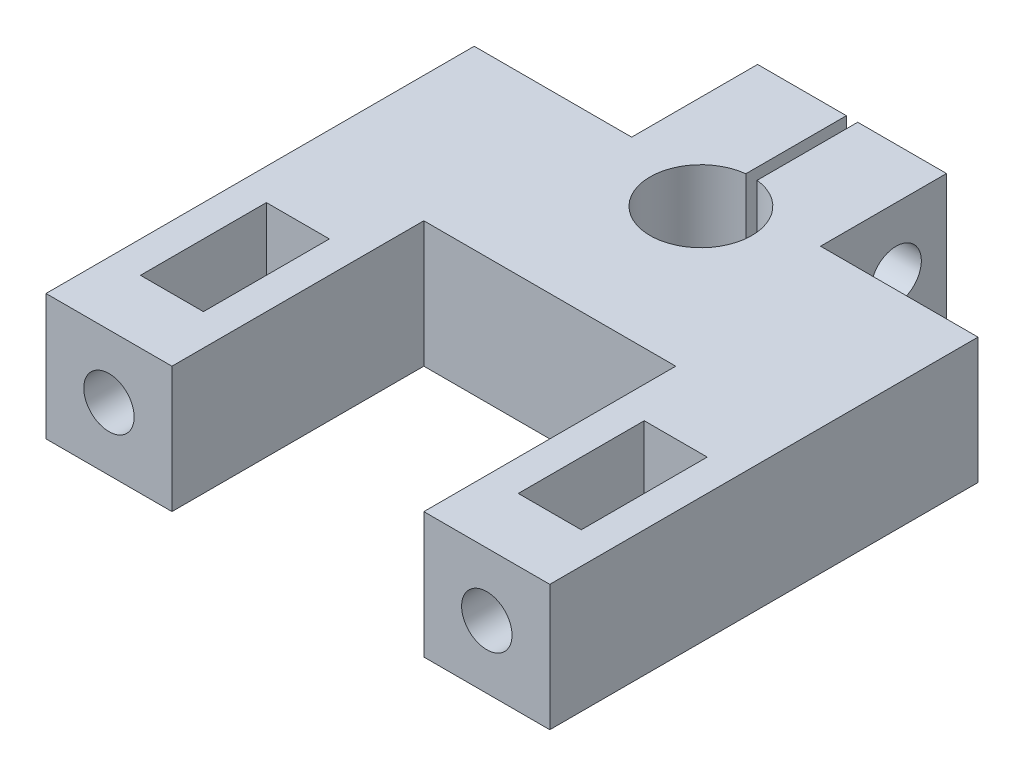
from build123d import *

# Parameters (mm, degrees)
BOSS_EXTRUDE1_DEPTH = 10
SKETCH2_R           = 2
CUT_EXTRUDE1_DEPTH  = 15
SKETCH3_R           = 2
CUT_EXTRUDE2_DEPTH  = 11
SKETCH4_W           = 40
SKETCH4_H           = 24
BOSS_EXTRUDE2_DEPTH = 10
SKETCH5_R           = 4.04
CUT_EXTRUDE3_DEPTH  = 41.693979899
SKETCH6_W           = 0.9
SKETCH6_H           = 12
CUT_EXTRUDE4_DEPTH  = 41.693979899
SKETCH8_R           = 2
CUT_EXTRUDE5_DEPTH  = 40
SKETCH9_W           = 12.5
SKETCH9_H           = 10
CUT_EXTRUDE6_DEPTH  = 40
SKETCH10_W          = 5
SKETCH10_H          = 10
CUT_EXTRUDE7_DEPTH  = 10


with BuildPart() as part:
    # Sketch1 → Boss-Extrude1 (new body)
    with BuildSketch(Plane(origin=(0, 0, 0), x_dir=(1, 0, 0), z_dir=(0, 1, 0))):
        Polygon((-20, -10), (-20, 20), (20, 20), (20, -10), (10, -10), (10, 10), (-10, 10), (-10, -10), align=None)
    extrude(amount=BOSS_EXTRUDE1_DEPTH)

    # Sketch2 → Cut-Extrude1 (cut)
    with BuildSketch(Plane.XY.offset(10)):
        with Locations((-15, 5)):
            Circle(SKETCH2_R)
        with Locations((15, 5)):
            Circle(SKETCH2_R)
    extrude(amount=-CUT_EXTRUDE1_DEPTH, mode=Mode.SUBTRACT)

    # Sketch3 → Cut-Extrude2 (cut)
    with BuildSketch(Plane.XY.offset(-10)):
        with Locations((0, 5)):
            Circle(SKETCH3_R)
    extrude(amount=-CUT_EXTRUDE2_DEPTH, mode=Mode.SUBTRACT)

    # Sketch4 → Boss-Extrude2 (add, through all)
    with BuildSketch(Plane(origin=(0, 10, 0), x_dir=(1, 0, 0), z_dir=(0, 1, 0))):
        with Locations((0, 22)):
            Rectangle(SKETCH4_W, SKETCH4_H)
    extrude(amount=-BOSS_EXTRUDE2_DEPTH)

    # Sketch5 → Cut-Extrude3 (cut, through all)
    with BuildSketch(Plane(origin=(0, 10, 0), x_dir=(1, 0, 0), z_dir=(0, 1, 0))):
        with Locations(Location((0, 22, 0), (0, 0, 270))):
            Circle(SKETCH5_R)
    extrude(amount=-CUT_EXTRUDE3_DEPTH, mode=Mode.SUBTRACT)

    # Sketch6 → Cut-Extrude4 (cut, through all)
    with BuildSketch(Plane(origin=(0, 10, 0), x_dir=(1, 0, 0), z_dir=(0, 1, 0))):
        with Locations((0, 28)):
            Rectangle(SKETCH6_W, SKETCH6_H)
    extrude(amount=-CUT_EXTRUDE4_DEPTH, mode=Mode.SUBTRACT)

    # Sketch8 → Cut-Extrude5 (cut)
    with BuildSketch(Plane.ZY.offset(20)):
        with Locations((-30, 5)):
            Circle(SKETCH8_R)
    extrude(amount=-CUT_EXTRUDE5_DEPTH, mode=Mode.SUBTRACT)

    # Sketch9 → Cut-Extrude6 (cut)
    with BuildSketch(Plane(origin=(0, 10, 0), x_dir=(1, 0, 0), z_dir=(0, 1, 0))):
        with Locations((13.75, 29)):
            Rectangle(SKETCH9_W, SKETCH9_H)
        with Locations((-13.75, 29)):
            Rectangle(SKETCH9_W, SKETCH9_H)
    extrude(amount=-CUT_EXTRUDE6_DEPTH, mode=Mode.SUBTRACT)

    # Sketch10 → Cut-Extrude7 (cut)
    with BuildSketch(Plane(origin=(0, 10, 0), x_dir=(1, 0, 0), z_dir=(0, 1, 0))):
        with Locations((-15, 0)):
            Rectangle(SKETCH10_W, SKETCH10_H)
        with Locations((15, 0)):
            Rectangle(SKETCH10_W, SKETCH10_H)
    extrude(amount=-CUT_EXTRUDE7_DEPTH, mode=Mode.SUBTRACT)


solid = part.part
